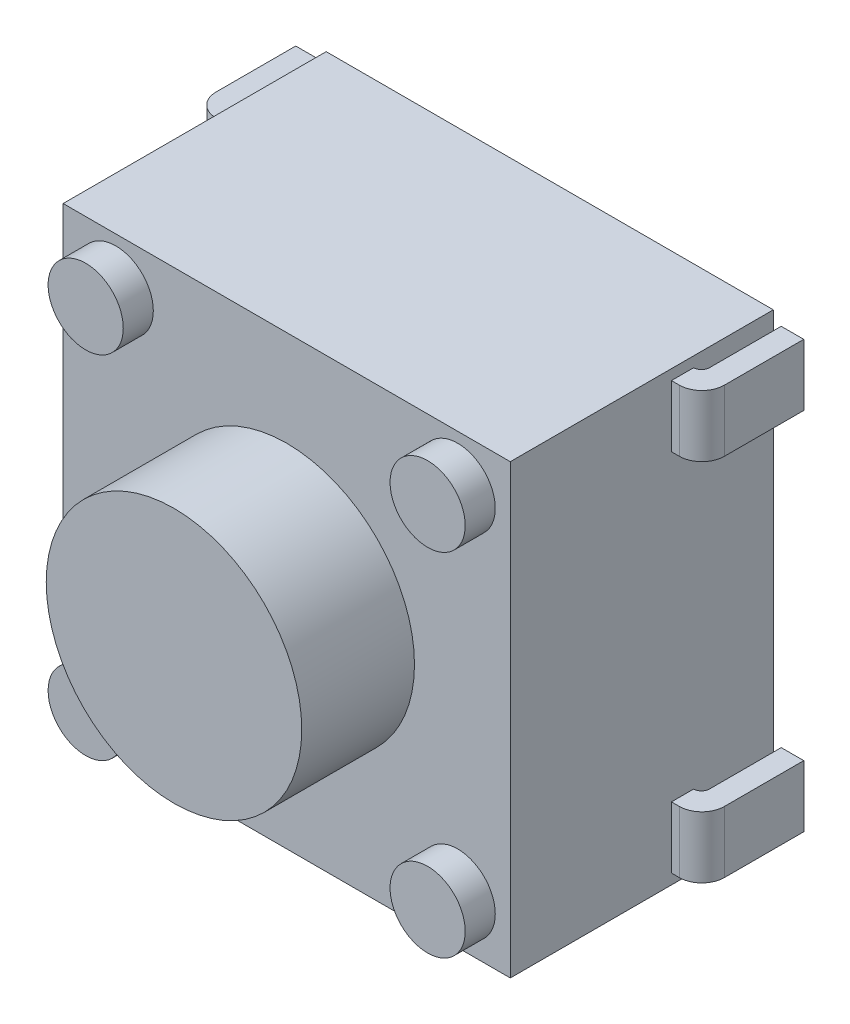
from build123d import *

# Parameters (mm, degrees)
CROQUIS1_W              = 5.95
CROQUIS1_H              = 5.95
SALIENTE_EXTRUIR1_DEPTH = 3.5
CROQUIS3_R              = 1.7
SALIENTE_EXTRUIR2_DEPTH = 1.5
CROQUIS4_R              = 0.5
SALIENTE_EXTRUIR3_DEPTH = 0.4
CROQUIS5_W              = 1.355791782
CROQUIS5_H              = 0.82
SALIENTE_EXTRUIR4_DEPTH = 0.405
REDONDEO1_R             = 0.3
REDONDEO2_R             = 0.3
CROQUIS9_W              = 1.36
CROQUIS9_H              = 0.82
SALIENTE_EXTRUIR5_DEPTH = 0.405
REDONDEO3_R             = 0.3
REDONDEO4_R             = 0.3
CORTAR_EXTRUIR1_DEPTH   = 10.958472837


with BuildPart() as part:
    # Croquis1 → Saliente-Extruir1 (new body)
    with BuildSketch(Plane.XY):
        with Locations((-2.975, 2.975)):
            Rectangle(CROQUIS1_W, CROQUIS1_H)
    extrude(amount=SALIENTE_EXTRUIR1_DEPTH)

    # Croquis3 → Saliente-Extruir2 (add)
    with BuildSketch(Plane.XY.offset(3.5)):
        with Locations((-2.975, 2.975)):
            Circle(CROQUIS3_R)
    extrude(amount=SALIENTE_EXTRUIR2_DEPTH)

    # Croquis4 → Saliente-Extruir3 (add)
    with BuildSketch(Plane.XY.offset(3.5)):
        with Locations((-5.25, 5.3125)):
            Circle(CROQUIS4_R)
        with Locations(Location((-0.7, 5.3125, 0), (0, 0, 180))):
            Circle(CROQUIS4_R)
        with Locations((-0.7, 0.6375)):
            Circle(CROQUIS4_R)
        with Locations(Location((-5.25, 0.6375, 0), (0, 0, 180))):
            Circle(CROQUIS4_R)
    extrude(amount=SALIENTE_EXTRUIR3_DEPTH)

    # Croquis5 → Saliente-Extruir4 (add)
    with BuildSketch(Plane(origin=(0, 0, 0), x_dir=(0, 0, -1), z_dir=(1, 0, 0))):
        with Locations((-0.677895891, 5.4025)):
            Rectangle(CROQUIS5_W, CROQUIS5_H)
        with Locations((-0.677895891, 0.5475)):
            Rectangle(CROQUIS5_W, CROQUIS5_H)
    extrude(amount=SALIENTE_EXTRUIR4_DEPTH)

    # Redondeo1
    redondeo1_edges = [part.edges().sort_by_distance(p)[0] for p in [
        (0.405, 5.4025, 1.355791782),
    ]]
    fillet(redondeo1_edges, radius=REDONDEO1_R)

    # Redondeo2
    redondeo2_edges = [part.edges().sort_by_distance(p)[0] for p in [
        (0.405, 0.5475, 1.355791782),
    ]]
    fillet(redondeo2_edges, radius=REDONDEO2_R)

    # Croquis9 → Saliente-Extruir5 (add)
    with BuildSketch(Plane.ZY.offset(5.95)):
        with Locations((0.68, 5.4025)):
            Rectangle(CROQUIS9_W, CROQUIS9_H)
        with Locations((0.68, 0.5475)):
            Rectangle(CROQUIS9_W, CROQUIS9_H)
    extrude(amount=SALIENTE_EXTRUIR5_DEPTH)

    # Redondeo3
    redondeo3_edges = [part.edges().sort_by_distance(p)[0] for p in [
        (-6.355, 5.4025, 1.36),
    ]]
    fillet(redondeo3_edges, radius=REDONDEO3_R)

    # Redondeo4
    redondeo4_edges = [part.edges().sort_by_distance(p)[0] for p in [
        (-6.355, 0.5475, 1.36),
    ]]
    fillet(redondeo4_edges, radius=REDONDEO4_R)

    # Croquis10 → Cortar-Extruir1 (cut, through all)
    with BuildSketch(Plane.XZ.offset(-0.1375)):
        with BuildLine():
            Line((-5.95, 0), (-6.055, 0))
            Line((-6.055, 0), (-6.055, 0.955))
            ThreePointArc((-6.055, 0.955), (-6.024246212, 1.029246212), (-5.95, 1.06))
            Line((-5.95, 1.06), (-5.95, 0))
        make_face()
        with BuildLine():
            Line((0.105, 0), (0.105, 0.955))
            ThreePointArc((0.105, 0.955), (0.074246212, 1.029246212), (0, 1.06))
            Line((0, 1.06), (0, 0))
            Line((0, 0), (0.105, 0))
        make_face()
    extrude(amount=-CORTAR_EXTRUIR1_DEPTH, mode=Mode.SUBTRACT)


solid = part.part
